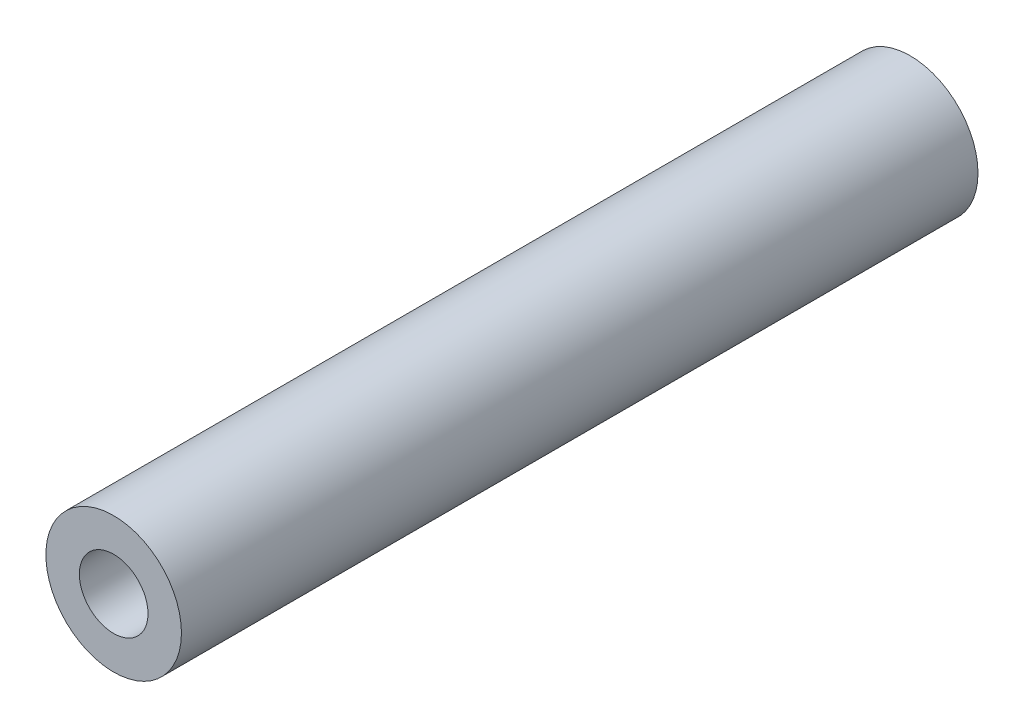
from build123d import *

# Parameters (mm, degrees)
S01_SOLID_POST_BLANK_16_MM_R             = 8
F_01_SOLID_POST_BLANK_16_MM_DEPTH        = 94
F_02_START                               = -0.1
S02_REAR_M6_HEAT_SET_INSERT_SEAT_R       = 4.05
F_02_REAR_M6_HEAT_SET_INSERT_SEAT_DEPTH  = 14.35
F_03_START                               = 79.75
S03_FRONT_M6_HEAT_SET_INSERT_SEAT_R      = 4.05
F_03_FRONT_M6_HEAT_SET_INSERT_SEAT_DEPTH = 14.35


with BuildPart() as part:
    # S01 - Solid post blank - 16 mm → 01 - Solid post blank - 16 mm (new body)
    with BuildSketch(Plane.XY):
        Circle(S01_SOLID_POST_BLANK_16_MM_R)
    extrude(amount=F_01_SOLID_POST_BLANK_16_MM_DEPTH)

    # S02 - Rear M6 heat-set insert seat → 02 - Rear M6 heat-set insert seat (cut)
    with BuildSketch(Plane.XY.offset(F_02_START)):
        Circle(S02_REAR_M6_HEAT_SET_INSERT_SEAT_R)
    extrude(amount=F_02_REAR_M6_HEAT_SET_INSERT_SEAT_DEPTH, mode=Mode.SUBTRACT)

    # S03 - Front M6 heat-set insert seat → 03 - Front M6 heat-set insert seat (cut)
    with BuildSketch(Plane.XY.offset(F_03_START)):
        Circle(S03_FRONT_M6_HEAT_SET_INSERT_SEAT_R)
    extrude(amount=F_03_FRONT_M6_HEAT_SET_INSERT_SEAT_DEPTH, mode=Mode.SUBTRACT)


solid = part.part
